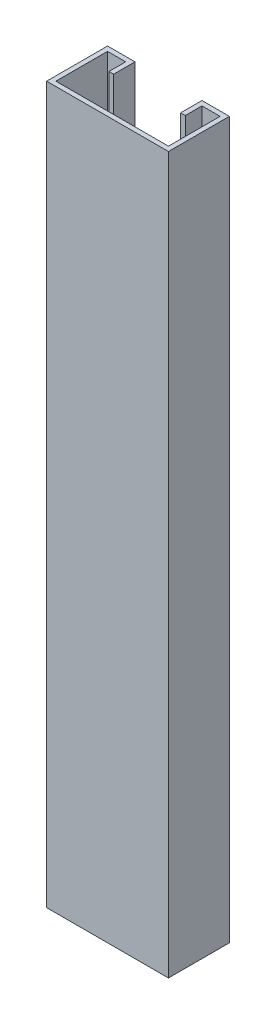
from build123d import *

# Parameters (mm, degrees)
SALIENTE_EXTRUIR4_DEPTH = 235


with BuildPart() as part:
    # Croquis4 → Saliente-Extruir4 (new body)
    with BuildSketch(Plane(origin=(0, 0, 0), x_dir=(1, 0, 0), z_dir=(0, 1, 0))):
        Polygon((0, 0), (0, 7), (-9, 7), (-9, -13), (31, -13), (31, 7), (22, 7), (22, 0), (23.52, 0), (23.52, 5.48), (29.48, 5.48), (29.48, -11.48), (-7.48, -11.48), (-7.48, 5.48), (-1.52, 5.48), (-1.52, 0), align=None)
    extrude(amount=SALIENTE_EXTRUIR4_DEPTH)


solid = part.part
